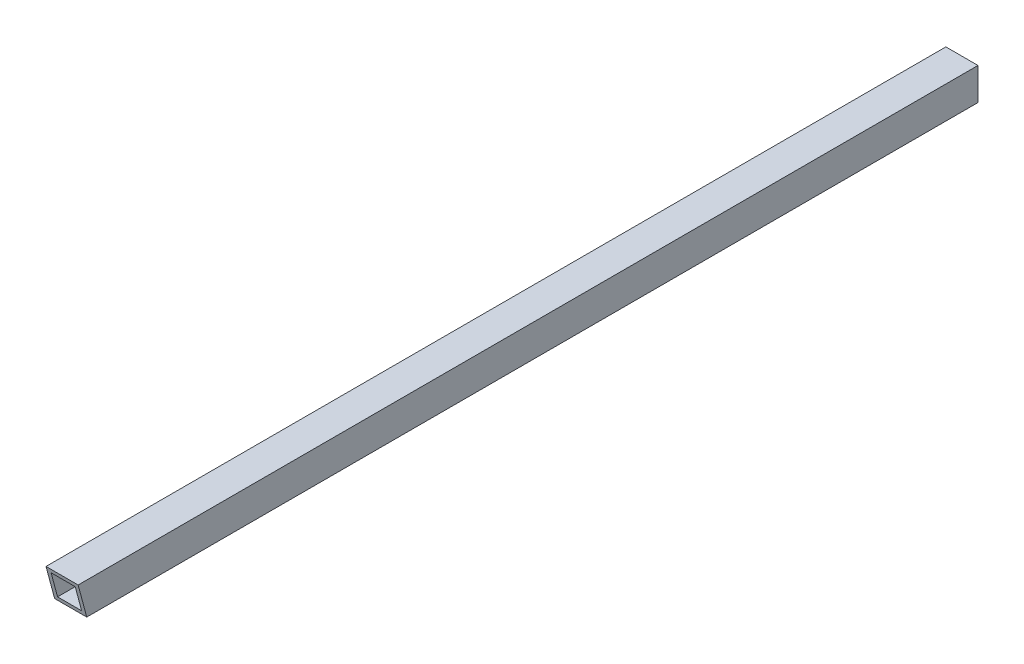
from build123d import *

# Parameters (mm, degrees)
SKETCH1_W           = 25.4
SKETCH1_H           = 25.4
SKETCH1_W_2         = 19.05
SKETCH1_H_2         = 19.05
BOSS_EXTRUDE1_DEPTH = 711.2
SKETCH3_W           = 25.4
SKETCH3_H           = 26.296014983
CUT_EXTRUDE2_DEPTH  = 688.193332203


with BuildPart() as part:
    # Sketch1 → Boss-Extrude1 (new body)
    with BuildSketch(Plane.XY):
        Rectangle(SKETCH1_W, SKETCH1_H)
        Rectangle(SKETCH1_W_2, SKETCH1_H_2, mode=Mode.SUBTRACT)
    extrude(amount=BOSS_EXTRUDE1_DEPTH)

    # Sketch3 → Cut-Extrude2 (cut, through all)
    with BuildSketch(Plane(origin=(0, -176.949261314, 660.383633586), x_dir=(-1, 0, 0), z_dir=(0, -0.25881904510250786, 0.9659258262890718))):
        with Locations((0, -183.19135538)):
            Rectangle(SKETCH3_W, SKETCH3_H)
    extrude(amount=CUT_EXTRUDE2_DEPTH, mode=Mode.SUBTRACT)


solid = part.part
